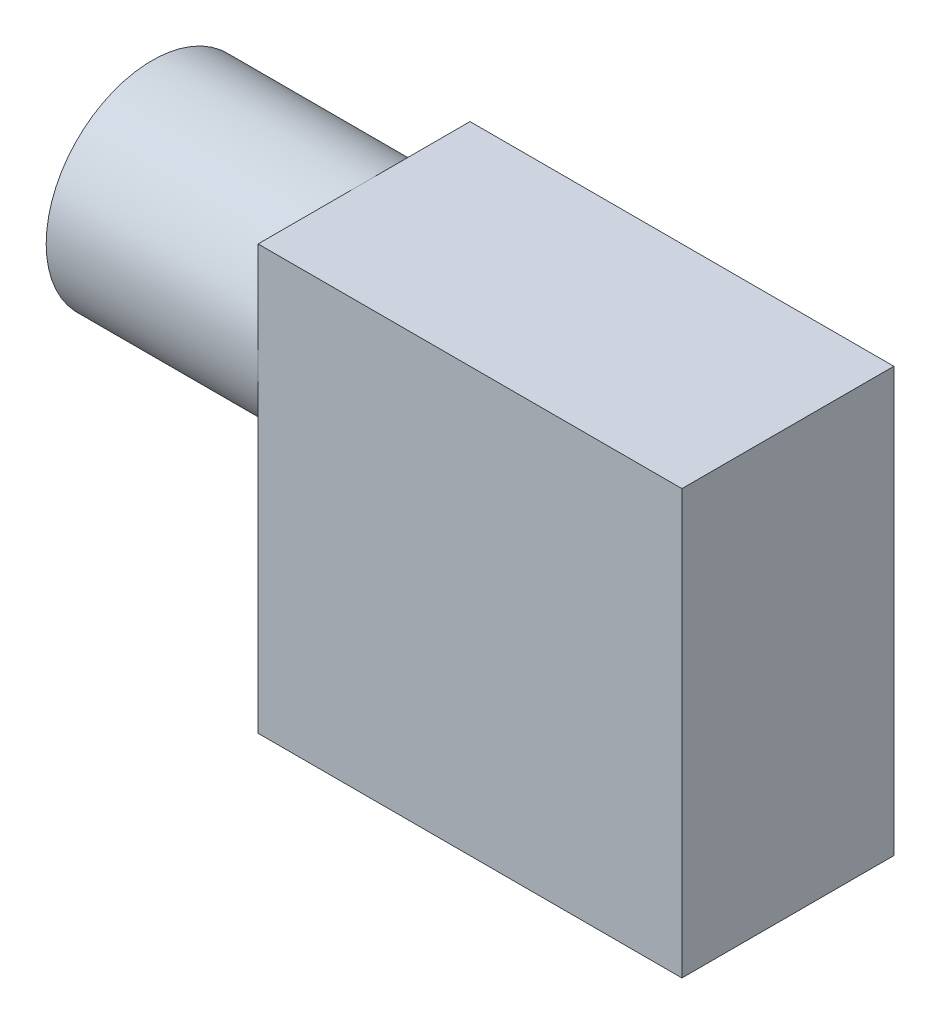
from build123d import *

# Parameters (mm, degrees)
SKETCH_1_W      = 20
SKETCH_1_H      = 20
EXTRUDE_1_DEPTH = 10
SKETCH_2_R      = 5
EXTRUDE_2_DEPTH = 10


with BuildPart() as part:
    # 草图1 → 凸台-拉伸1 (new body)
    with BuildSketch(Plane.XY):
        with Locations((10, -10)):
            Rectangle(SKETCH_1_W, SKETCH_1_H)
    extrude(amount=EXTRUDE_1_DEPTH)

    # 草图2 → 凸台-拉伸2 (add)
    with BuildSketch(Plane.ZY):
        with Locations((5, -5)):
            Circle(SKETCH_2_R)
    extrude(amount=EXTRUDE_2_DEPTH)


solid = part.part
